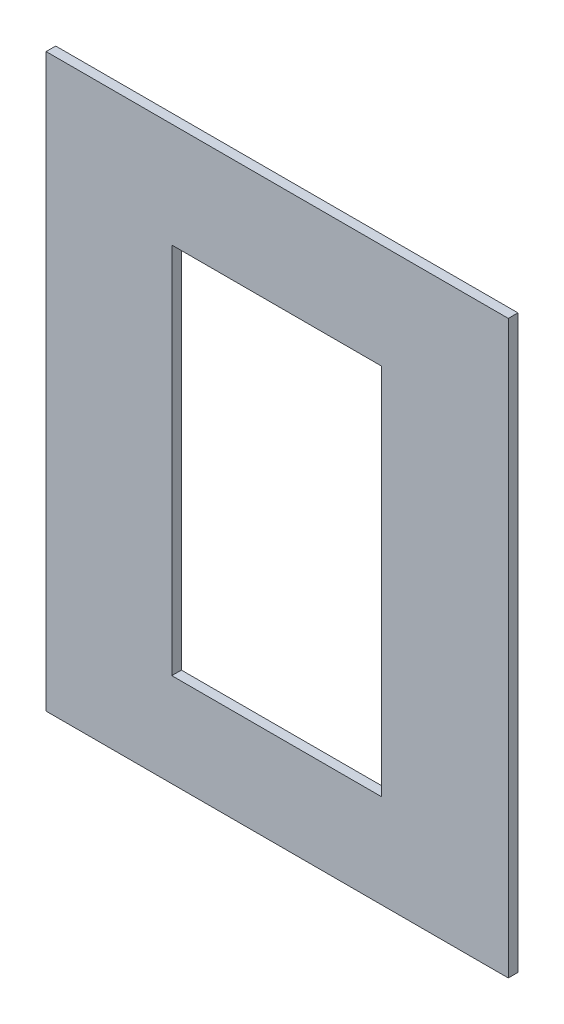
from build123d import *

# Parameters (mm, degrees)
SKETCH1_W           = 877.8875
SKETCH1_H           = 1085.05625
BOSS_EXTRUDE1_DEPTH = 18.25625
SKETCH2_W           = 398.526
SKETCH2_H           = 708.406
CUT_EXTRUDE1_DEPTH  = 19.05


with BuildPart() as part:
    # Sketch1 → Boss-Extrude1 (new body)
    with BuildSketch(Plane.XY):
        Rectangle(SKETCH1_W, SKETCH1_H)
    extrude(amount=BOSS_EXTRUDE1_DEPTH)

    # Sketch2 → Cut-Extrude1 (cut)
    with BuildSketch(Plane.XY.offset(18.25625)):
        with Locations((-0.92075, -10.535082227)):
            Rectangle(SKETCH2_W, SKETCH2_H)
    extrude(amount=-CUT_EXTRUDE1_DEPTH, mode=Mode.SUBTRACT)


solid = part.part
